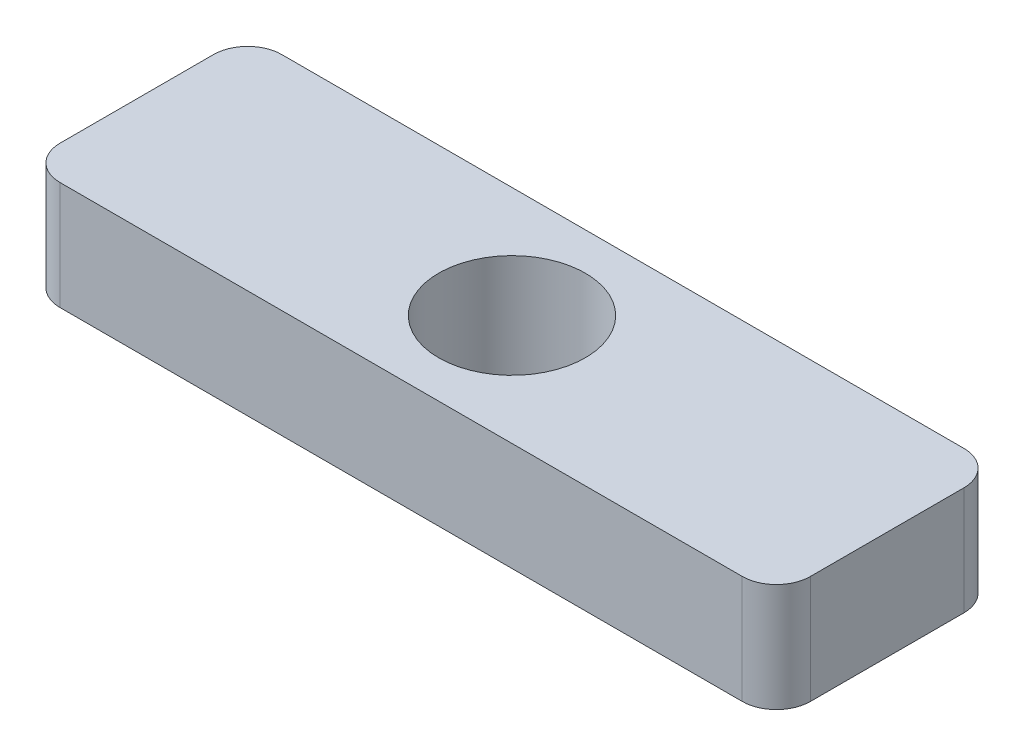
from build123d import *

# Parameters (mm, degrees)
SKETCH2_W           = 22
SKETCH2_H           = 6.5
BOSS_EXTRUDE2_DEPTH = 3.175
SKETCH3_R           = 2.15
CUT_EXTRUDE1_DEPTH  = 3.175
FILLET2_R           = 1


with BuildPart() as part:
    # Sketch2 → Boss-Extrude2 (new body)
    with BuildSketch(Plane(origin=(0, 0, 0), x_dir=(1, 0, 0), z_dir=(0, 1, 0))):
        Rectangle(SKETCH2_W, SKETCH2_H)
    extrude(amount=BOSS_EXTRUDE2_DEPTH)

    # Sketch3 → Cut-Extrude1 (cut)
    with BuildSketch(Plane(origin=(0, 3.175, 0), x_dir=(1, 0, 0), z_dir=(0, 1, 0))):
        with Locations(Location((0, 0, 0), (0, 0, 270))):
            Circle(SKETCH3_R)
    extrude(amount=-CUT_EXTRUDE1_DEPTH, mode=Mode.SUBTRACT)

    # Fillet2
    fillet2_edges = [part.edges().sort_by_distance(p)[0] for p in [
        (11, 1.5875, 3.25),
        (-11, 1.5875, 3.25),
        (-11, 1.5875, -3.25),
        (11, 1.5875, -3.25),
    ]]
    fillet(fillet2_edges, radius=FILLET2_R)


solid = part.part
